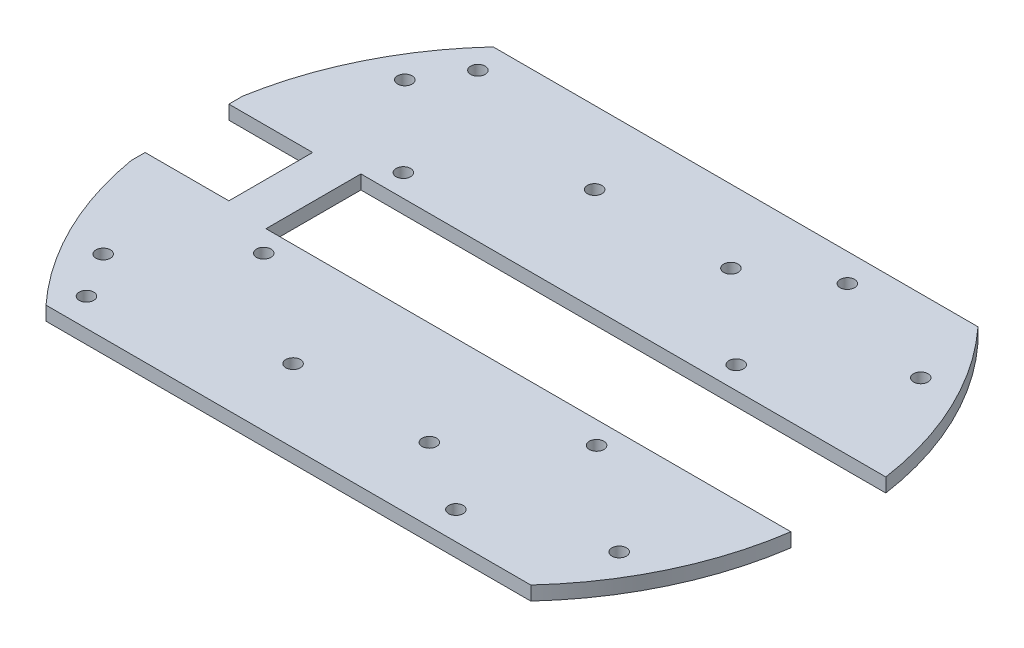
from build123d import *

# Parameters (mm, degrees)
SKETCH1_R           = 1.651
BOSS_EXTRUDE1_DEPTH = 3.175
SKETCH2_W           = 19.05
SKETCH2_H           = 19.05
CUT_EXTRUDE1_DEPTH  = 3.175


with BuildPart() as part:
    # Sketch1 → Boss-Extrude1 (new body)
    with BuildSketch(Plane(origin=(0, 0, 0), x_dir=(1, 0, 0), z_dir=(0, 1, 0))):
        with BuildLine():
            Line((-73.916912814, 12.7), (-73.916912814, -12.7))
            ThreePointArc((-73.916912814, -12.7), (-67.281551776, -33.138991997), (-55.122759171, -50.857461806))
            Line((-55.122759171, -50.857461806), (55.122759171, -50.857461806))
            ThreePointArc((55.122759171, -50.857461806), (67.702114955, -32.271095901), (74.219053989, -10.795))
            Line((74.219053989, -10.795), (-45.158734092, -10.795))
            Line((-45.158734092, -10.795), (-45.158734092, 10.795))
            Line((-45.158734092, 10.795), (74.219053989, 10.795))
            ThreePointArc((74.219053989, 10.795), (67.702114955, 32.271095901), (55.122759171, 50.857461806))
            Line((55.122759171, 50.857461806), (-55.122759171, 50.857461806))
            ThreePointArc((-55.122759171, 50.857461806), (-67.281551776, 33.138991997), (-73.916912814, 12.7))
        make_face()
        with Locations(Location((31.75, 44.507461806, 0), (0, 0, 270))):
            Circle(SKETCH1_R, mode=Mode.SUBTRACT)
        with Locations(Location((35.105265908, 15.875, 0), (0, 0, 270))):
            Circle(SKETCH1_R, mode=Mode.SUBTRACT)
        with Locations(Location((35.105265908, -15.875, 0), (0, 0, 270))):
            Circle(SKETCH1_R, mode=Mode.SUBTRACT)
        with Locations(Location((-40.594426833, -15.875, 0), (0, 0, 270))):
            Circle(SKETCH1_R, mode=Mode.SUBTRACT)
        with Locations(Location((-40.594426833, 15.875, 0), (0, 0, 270))):
            Circle(SKETCH1_R, mode=Mode.SUBTRACT)
        with Locations(Location((31.75, -44.507461806, 0), (0, 0, 270))):
            Circle(SKETCH1_R, mode=Mode.SUBTRACT)
        with Locations(Location((-52.26766059, -44.507461806, 0), (0, 0, 270))):
            Circle(SKETCH1_R, mode=Mode.SUBTRACT)
        with Locations(Location((-52.26766059, 44.507461806, 0), (0, 0, 270))):
            Circle(SKETCH1_R, mode=Mode.SUBTRACT)
        with Locations(Location((-58.676912814, 34.29, 0), (0, 0, 270))):
            Circle(SKETCH1_R, mode=Mode.SUBTRACT)
        with Locations(Location((-15.496912814, 34.29, 0), (0, 0, 270))):
            Circle(SKETCH1_R, mode=Mode.SUBTRACT)
        with Locations(Location((-15.496912814, -34.29, 0), (0, 0, 270))):
            Circle(SKETCH1_R, mode=Mode.SUBTRACT)
        with Locations(Location((-58.676912814, -34.29, 0), (0, 0, 270))):
            Circle(SKETCH1_R, mode=Mode.SUBTRACT)
        with Locations(Location((15.496912814, -34.29, 0), (0, 0, 90))):
            Circle(SKETCH1_R, mode=Mode.SUBTRACT)
        with Locations(Location((58.676912814, -34.29, 0), (0, 0, 90))):
            Circle(SKETCH1_R, mode=Mode.SUBTRACT)
        with Locations(Location((58.676912814, 34.29, 0), (0, 0, 90))):
            Circle(SKETCH1_R, mode=Mode.SUBTRACT)
        with Locations(Location((15.496912814, 34.29, 0), (0, 0, 90))):
            Circle(SKETCH1_R, mode=Mode.SUBTRACT)
    extrude(amount=BOSS_EXTRUDE1_DEPTH)

    # Sketch2 → Cut-Extrude1 (cut)
    with BuildSketch(Plane(origin=(0, 3.175, 0), x_dir=(1, 0, 0), z_dir=(0, 1, 0))):
        with Locations((-64.391912814, 0)):
            Rectangle(SKETCH2_W, SKETCH2_H)
    extrude(amount=-CUT_EXTRUDE1_DEPTH, mode=Mode.SUBTRACT)


solid = part.part
